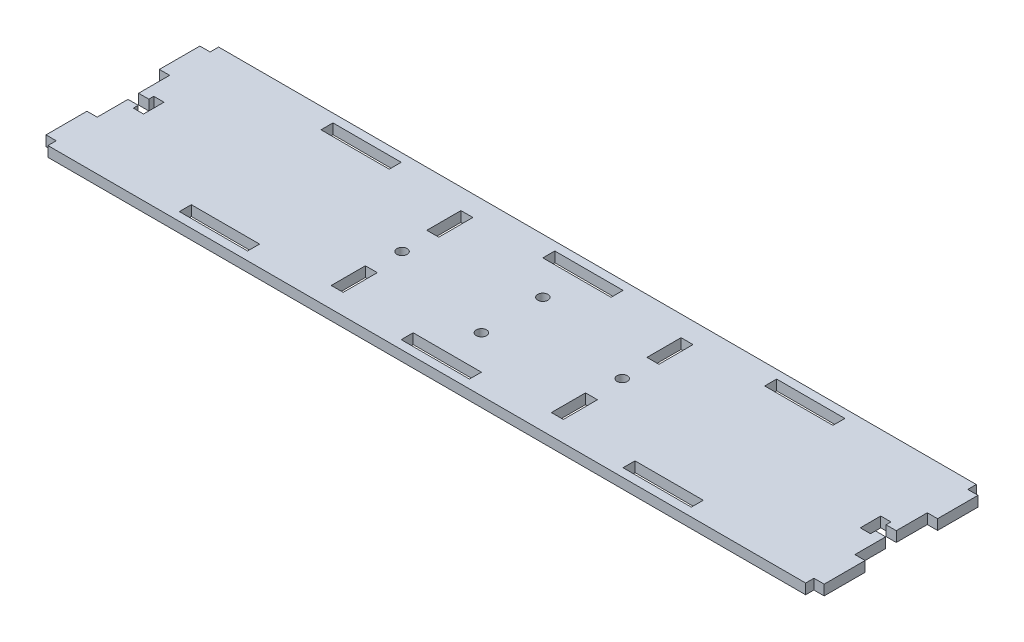
from build123d import *

# Parameters (mm, degrees)
CROQUIS1_R              = 1.5
CROQUIS1_W              = 20
CROQUIS1_H              = 3.5
CROQUIS1_W_2            = 3.5
CROQUIS1_H_2            = 10
SALIENTE_EXTRUIR1_DEPTH = 3
CROQUIS2_W              = 11.85
CROQUIS2_H              = 3
CROQUIS2_W_2            = 12
SALIENTE_EXTRUIR2_DEPTH = 3


with BuildPart() as part:
    # Croquis1 → Saliente-Extruir1 (new body)
    with BuildSketch(Plane(origin=(0, 0, 0), x_dir=(1, 0, 0), z_dir=(0, 1, 0))):
        Polygon((111, -25), (-111, -25), (-111, -1.55), (-108, -1.55), (-108, -3), (-105, -3), (-105, 3), (-108, 3), (-108, 1.55), (-111, 1.55), (-111, 25), (111, 25), (111, 1.55), (108, 1.55), (108, 3), (105, 3), (105, -3), (108, -3), (108, -1.55), (111, -1.55), align=None)
        with Locations(Location((-32.25, 0, 0), (0, 0, 270))):
            Circle(CROQUIS1_R, mode=Mode.SUBTRACT)
        with Locations(Location((32.25, 0, 0), (0, 0, 90))):
            Circle(CROQUIS1_R, mode=Mode.SUBTRACT)
        with Locations(Location((0, -9, 0), (0, 0, 270))):
            Circle(CROQUIS1_R, mode=Mode.SUBTRACT)
        with Locations(Location((0, 9, 0), (0, 0, 90))):
            Circle(CROQUIS1_R, mode=Mode.SUBTRACT)
        with Locations((65, 20.75)):
            Rectangle(CROQUIS1_W, CROQUIS1_H, mode=Mode.SUBTRACT)
        with Locations((0, 20.75)):
            Rectangle(CROQUIS1_W, CROQUIS1_H, mode=Mode.SUBTRACT)
        with Locations((-65, 20.75)):
            Rectangle(CROQUIS1_W, CROQUIS1_H, mode=Mode.SUBTRACT)
        with Locations((65, -20.75)):
            Rectangle(CROQUIS1_W, CROQUIS1_H, mode=Mode.SUBTRACT)
        with Locations((0, -20.75)):
            Rectangle(CROQUIS1_W, CROQUIS1_H, mode=Mode.SUBTRACT)
        with Locations((-65, -20.75)):
            Rectangle(CROQUIS1_W, CROQUIS1_H, mode=Mode.SUBTRACT)
        with Locations((-32.25, 14)):
            Rectangle(CROQUIS1_W_2, CROQUIS1_H_2, mode=Mode.SUBTRACT)
        with Locations((-32.25, -14)):
            Rectangle(CROQUIS1_W_2, CROQUIS1_H_2, mode=Mode.SUBTRACT)
        with Locations((32.25, 14)):
            Rectangle(CROQUIS1_W_2, CROQUIS1_H_2, mode=Mode.SUBTRACT)
        with Locations((32.25, -14)):
            Rectangle(CROQUIS1_W_2, CROQUIS1_H_2, mode=Mode.SUBTRACT)
    extrude(amount=SALIENTE_EXTRUIR1_DEPTH)

    # Croquis2 → Saliente-Extruir2 (add)
    with BuildSketch(Plane.ZY.offset(111)):
        with Locations((-16.575, 1.5)):
            Rectangle(CROQUIS2_W, CROQUIS2_H)
        with Locations((16.575, 1.5)):
            Rectangle(CROQUIS2_W_2, CROQUIS2_H)
    saliente_extruir2 = extrude(amount=SALIENTE_EXTRUIR2_DEPTH)

    # Simetría1: Saliente-Extruir2 across plane
    add(saliente_extruir2.mirror(Plane(origin=(0, 0, 0), x_dir=(0, 0, 1), z_dir=(1, 0, 0))))


solid = part.part
